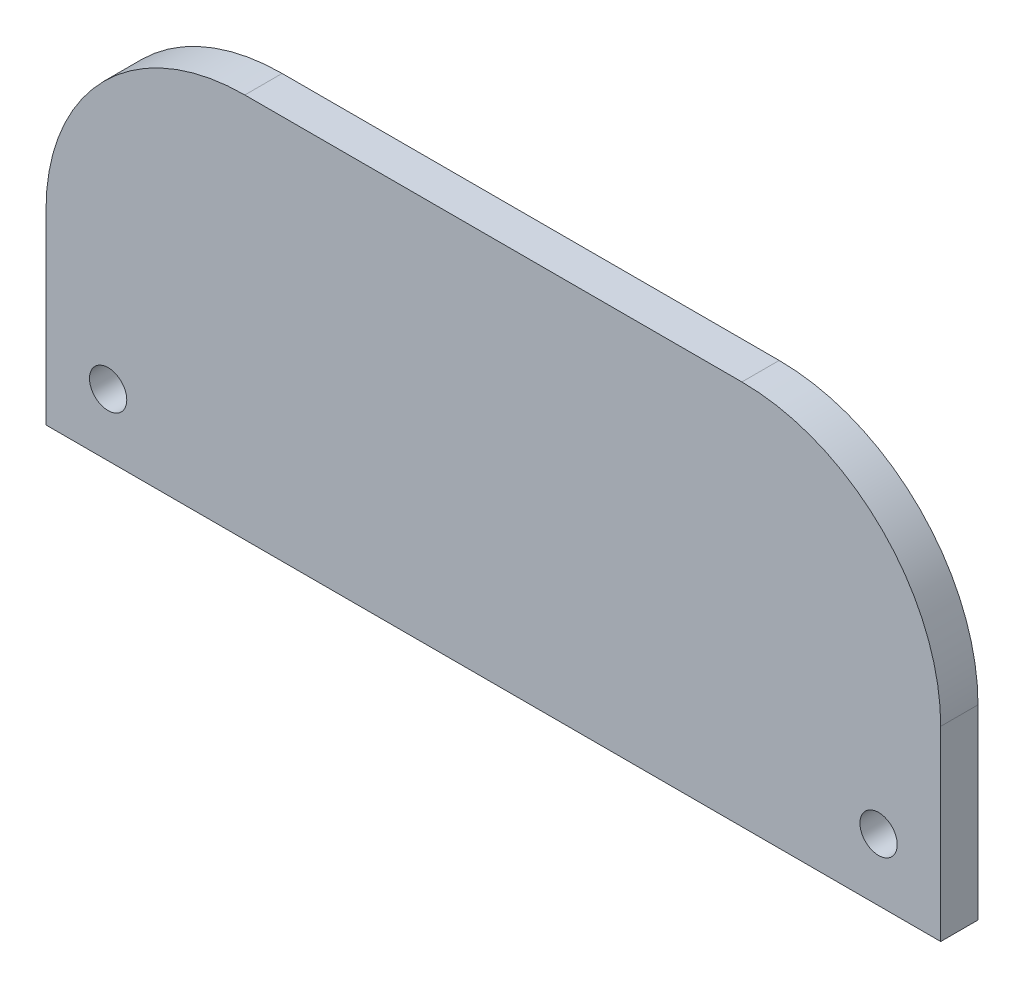
from build123d import *

# Parameters (mm, degrees)
SKETCH1_W               = 70
SKETCH1_H               = 70
BOSS_EXTRUDE1_DEPTH     = 10
SKETCH2_R               = 12
SKETCH2_R_2             = 2
SKETCH2_R_3             = 11.5
CUT_EXTRUDE1_DEPTH      = 10
SKETCH3_W               = 10
SKETCH3_H               = 70
BOSS_EXTRUDE2_DEPTH     = 15
SKETCH4_W               = 10
SKETCH4_H               = 70
BOSS_EXTRUDE3_DEPTH     = 15
SKETCH5_R               = 11.5
SKETCH5_R_2             = 4
BOSS_EXTRUDE4_DEPTH     = 2
SKETCH6_R               = 1.5
SKETCH6_R_2             = 1.648708122
CUT_EXTRUDE3_DEPTH      = 10
BOSS_EXTRUDE5_START     = -10
SKETCH7_R               = 11.986708095
SKETCH7_R_2             = 2
BOSS_EXTRUDE5_DEPTH     = 10
SKETCH8_R               = 12
CUT_EXTRUDE4_DEPTH      = 10
SKETCH9_R               = 2
CUT_EXTRUDE5_DEPTH      = 10
CUT_EXTRUDE7_DEPTH      = 5
SKETCH15_W              = 14
SKETCH15_H              = 70
CUT_EXTRUDE8_DEPTH      = 5
CUT_EXTRUDE9_DEPTH      = 19
CUT_EXTRUDE9_DEPTH_BACK = 48
SKETCH16_R              = 1.5
SKETCH17_R              = 5
CUT_EXTRUDE10_DEPTH     = 19
SKETCH18_W              = 44.558304453
SKETCH18_H              = 39
BOSS_EXTRUDE6_DEPTH     = 5
SKETCH19_R              = 1.5
SKETCH19_R_2            = 5
BOSS_EXTRUDE7_DEPTH     = 3
SKETCH20_W              = 72
SKETCH20_H              = 10
CUT_EXTRUDE11_DEPTH     = 77


with BuildPart() as part:
    # Sketch1 → Boss-Extrude1 (new body)
    with BuildSketch(Plane.XY):
        with Locations((35, 35)):
            Rectangle(SKETCH1_W, SKETCH1_H)
    extrude(amount=BOSS_EXTRUDE1_DEPTH)

    # Sketch2 → Cut-Extrude1 (cut)
    with BuildSketch(Plane.XY.offset(10)):
        with Locations((35, 49)):
            Circle(SKETCH2_R)
        with Locations((19.5, 65)):
            Circle(SKETCH2_R_2)
        with Locations((50.5, 65)):
            Circle(SKETCH2_R_2)
        with Locations((19.5, 34)):
            Circle(SKETCH2_R_2)
        with Locations((50.5, 34)):
            Circle(SKETCH2_R_2)
        with Locations((15, 15)):
            Circle(SKETCH2_R_3)
        with Locations((55, 15)):
            Circle(SKETCH2_R_3)
    extrude(amount=-CUT_EXTRUDE1_DEPTH, mode=Mode.SUBTRACT)

    # Sketch3 → Boss-Extrude2 (add)
    with BuildSketch(Plane.ZY):
        with Locations((5, 35)):
            Rectangle(SKETCH3_W, SKETCH3_H)
    extrude(amount=BOSS_EXTRUDE2_DEPTH)

    # Sketch4 → Boss-Extrude3 (add)
    with BuildSketch(Plane(origin=(70, 0, 0), x_dir=(0, 0, -1), z_dir=(1, 0, 0))):
        with Locations((-5, 35)):
            Rectangle(SKETCH4_W, SKETCH4_H)
    extrude(amount=BOSS_EXTRUDE3_DEPTH)

    # Sketch5 → Boss-Extrude4 (add)
    # profile 1 of 2: a face of its own
    with BuildSketch(Plane.XY.offset(10)):
        with Locations((15, 15)):
            Circle(SKETCH5_R)
        with Locations((15, 15)):
            Circle(SKETCH5_R_2, mode=Mode.SUBTRACT)
    # profile 2 of 2: a face of its own
    with BuildSketch(Plane.XY.offset(10)):
        with Locations((55, 15)):
            Circle(SKETCH5_R)
        with Locations((55, 15)):
            Circle(SKETCH5_R_2, mode=Mode.SUBTRACT)
    extrude(amount=-BOSS_EXTRUDE4_DEPTH)

    # Sketch6 → Cut-Extrude3 (cut)
    with BuildSketch(Plane(origin=(0, 0, 0), x_dir=(-1, 0, 0), z_dir=(0, 0, -1))):
        with Locations((-80, 65)):
            Circle(SKETCH6_R)
        with Locations((-80, 5)):
            Circle(SKETCH6_R)
        with Locations((10, 65)):
            Circle(SKETCH6_R_2)
        with Locations((10, 5)):
            Circle(SKETCH6_R)
    extrude(amount=-CUT_EXTRUDE3_DEPTH, mode=Mode.SUBTRACT)

    # Sketch7 → Boss-Extrude5 (add)
    with BuildSketch(Plane(origin=(0, 0, 0), x_dir=(-1, 0, 0), z_dir=(0, 0, -1)).offset(BOSS_EXTRUDE5_START)):
        with Locations((-35, 49)):
            Circle(SKETCH7_R)
        with Locations((-50.5, 65)):
            Circle(SKETCH7_R_2)
        with Locations((-19.5, 65)):
            Circle(SKETCH7_R_2)
        with Locations((-19.5, 34)):
            Circle(SKETCH7_R_2)
        with Locations((-50.5, 34)):
            Circle(SKETCH7_R_2)
    extrude(amount=BOSS_EXTRUDE5_DEPTH)


with BuildPart() as boss_extrude5_piece_1:
    # of the separate pieces the step leaves, piece 1, a body of its own (boss_extrude5_pieces)
    add(part.part.solids().sort_by_distance((-15, 0, 0))[0])


with BuildPart() as boss_extrude5_piece_2:
    # of the separate pieces the step leaves, piece 2, a body of its own (boss_extrude5_pieces)
    add(part.part.solids().sort_by_distance((23.013291905, 49, 10))[0])


with BuildPart() as cut_extrude4_tool:
    # Sketch8 → Cut-Extrude4 (new body)
    with BuildSketch(Plane(origin=(0, 0, 0), x_dir=(-1, 0, 0), z_dir=(0, 0, -1))):
        with Locations((-33.928692494, 49)):
            Circle(SKETCH8_R)
    extrude(amount=-CUT_EXTRUDE4_DEPTH)


with BuildPart() as boss_extrude5_piece_1_1:
    add(boss_extrude5_piece_1.part)

    # Cut-Extrude4: cut by cut_extrude4_tool
    add(cut_extrude4_tool.part, mode=Mode.SUBTRACT)

    # Sketch9 → Cut-Extrude5 (cut)
    with BuildSketch(Plane(origin=(0, 0, 0), x_dir=(-1, 0, 0), z_dir=(0, 0, -1))):
        with Locations((-49.428692494, 64.5)):
            Circle(SKETCH9_R)
        with Locations((-49.428692494, 33.5)):
            Circle(SKETCH9_R)
        with Locations((-18.428692494, 33.5)):
            Circle(SKETCH9_R)
        with Locations((-18.428692494, 64.5)):
            Circle(SKETCH9_R)
    extrude(amount=-CUT_EXTRUDE5_DEPTH, mode=Mode.SUBTRACT)


with BuildPart() as boss_extrude5_piece_2_1:
    add(boss_extrude5_piece_2.part)

    # Cut-Extrude4: cut by cut_extrude4_tool
    add(cut_extrude4_tool.part, mode=Mode.SUBTRACT)


with BuildPart() as cut_extrude7_tool:
    # Sketch14 → Cut-Extrude7 (new body)
    with BuildSketch(Plane(origin=(0, 0, 0), x_dir=(-1, 0, 0), z_dir=(0, 0, -1))):
        with BuildLine():
            Line((-85, 0), (-85, 70))
            Line((-85, 70), (15, 70))
            Line((15, 70), (15, 0))
            Line((15, 0), (1, 0))
            Line((1, 0), (1, 15))
            ThreePointArc((1, 15), (-15, 31), (-31, 15))
            Line((-31, 15), (-31, 0))
            Line((-31, 0), (-39, 0))
            Line((-39, 0), (-39, 15))
            ThreePointArc((-39, 15), (-55, 31), (-71, 15))
            Line((-71, 15), (-71, 0))
            Line((-71, 0), (-85, 0))
        make_face()
    extrude(amount=-CUT_EXTRUDE7_DEPTH)


with BuildPart() as boss_extrude5_piece_1_2:
    add(boss_extrude5_piece_1_1.part)

    # Cut-Extrude7: cut by cut_extrude7_tool
    add(cut_extrude7_tool.part, mode=Mode.SUBTRACT)

    # Sketch15 → Cut-Extrude8 (cut)
    with BuildSketch(Plane(origin=(0, 0, 5), x_dir=(-1, 0, 0), z_dir=(0, 0, -1))):
        with Locations((-78, 35)):
            Rectangle(SKETCH15_W, SKETCH15_H)
        with Locations((8, 35)):
            Rectangle(SKETCH15_W, SKETCH15_H)
    extrude(amount=-CUT_EXTRUDE8_DEPTH, mode=Mode.SUBTRACT)

    # Sketch16 → Cut-Extrude9 (cut, two sides: drawn at the far end of the back side and taken through both)
    with BuildSketch(Plane(origin=(0, 0, 5), x_dir=(-1, 0, 0), z_dir=(0, 0, -1)).offset(-CUT_EXTRUDE9_DEPTH_BACK)):
        with Locations((-66, 65)):
            Circle(SKETCH16_R)
        with Locations((-66, 5)):
            Circle(SKETCH16_R)
        with Locations((-4, 5)):
            Circle(SKETCH16_R)
        with Locations((-4, 65)):
            Circle(SKETCH16_R)
    extrude(amount=CUT_EXTRUDE9_DEPTH + CUT_EXTRUDE9_DEPTH_BACK, mode=Mode.SUBTRACT)

    # Sketch17 → Cut-Extrude10 (cut)
    with BuildSketch(Plane(origin=(0, 0, 8), x_dir=(-1, 0, 0), z_dir=(0, 0, -1))):
        with Locations((-15, 15)):
            Circle(SKETCH17_R)
        with Locations((-55, 15)):
            Circle(SKETCH17_R)
    extrude(amount=-CUT_EXTRUDE10_DEPTH, mode=Mode.SUBTRACT)



with BuildPart() as boss_extrude5_piece_2_2:
    add(boss_extrude5_piece_2_1.part)

    # Cut-Extrude7: cut by cut_extrude7_tool
    add(cut_extrude7_tool.part, mode=Mode.SUBTRACT)


with BuildPart() as boss_extrude5_piece_1_3:
    add(boss_extrude5_piece_1_2.part)

    add(boss_extrude5_piece_2_2.part)  # Boss-Extrude6 merges Boss-Extrude5 piece 2
    # Sketch18 → Boss-Extrude6 (add)
    with BuildSketch(Plane(origin=(0, 0, 5), x_dir=(-1, 0, 0), z_dir=(0, 0, -1))):
        with Locations((-37.279152227, 50.5)):
            Rectangle(SKETCH18_W, SKETCH18_H)
    extrude(amount=-BOSS_EXTRUDE6_DEPTH)

    # Sketch19 → Boss-Extrude7 (add)
    # profile 1 of 3: a face of its own
    with BuildSketch(Plane.XY.offset(10)):
        with BuildLine():
            Line((71, 0), (71, 15))
            ThreePointArc((71, 15), (66.313708499, 26.313708499), (55, 31))
            Line((55, 31), (15, 31))
            ThreePointArc((15, 31), (3.686291501, 26.313708499), (-1, 15))
            Line((-1, 15), (-1, 0))
            Line((-1, 0), (71, 0))
        make_face()
        with Locations(Location((4, 5, 0), (0, 0, 180))):
            Circle(SKETCH19_R, mode=Mode.SUBTRACT)
        with Locations(Location((15, 15, 0), (0, 0, 180))):
            Circle(SKETCH19_R_2, mode=Mode.SUBTRACT)
        with Locations(Location((66, 5, 0), (0, 0, 180))):
            Circle(SKETCH19_R, mode=Mode.SUBTRACT)
        with Locations(Location((55, 15, 0), (0, 0, 180))):
            Circle(SKETCH19_R_2, mode=Mode.SUBTRACT)
    # profile 2 of 3: a face of its own
    with BuildSketch(Plane.XY.offset(10)):
        with Locations(Location((55, 15, 0), (0, 0, 180))):
            Circle(SKETCH19_R_2)
    # profile 3 of 3: a face of its own
    with BuildSketch(Plane.XY.offset(10)):
        with Locations(Location((15, 15, 0), (0, 0, 180))):
            Circle(SKETCH19_R_2)
    extrude(amount=BOSS_EXTRUDE7_DEPTH)

    # Sketch20 → Cut-Extrude11 (cut)
    with BuildSketch(Plane(origin=(0, 70, 0), x_dir=(1, 0, 0), z_dir=(0, 1, 0))):
        with Locations((35, -5)):
            Rectangle(SKETCH20_W, SKETCH20_H)
    extrude(amount=-CUT_EXTRUDE11_DEPTH, mode=Mode.SUBTRACT)


solid = boss_extrude5_piece_1_3.part
